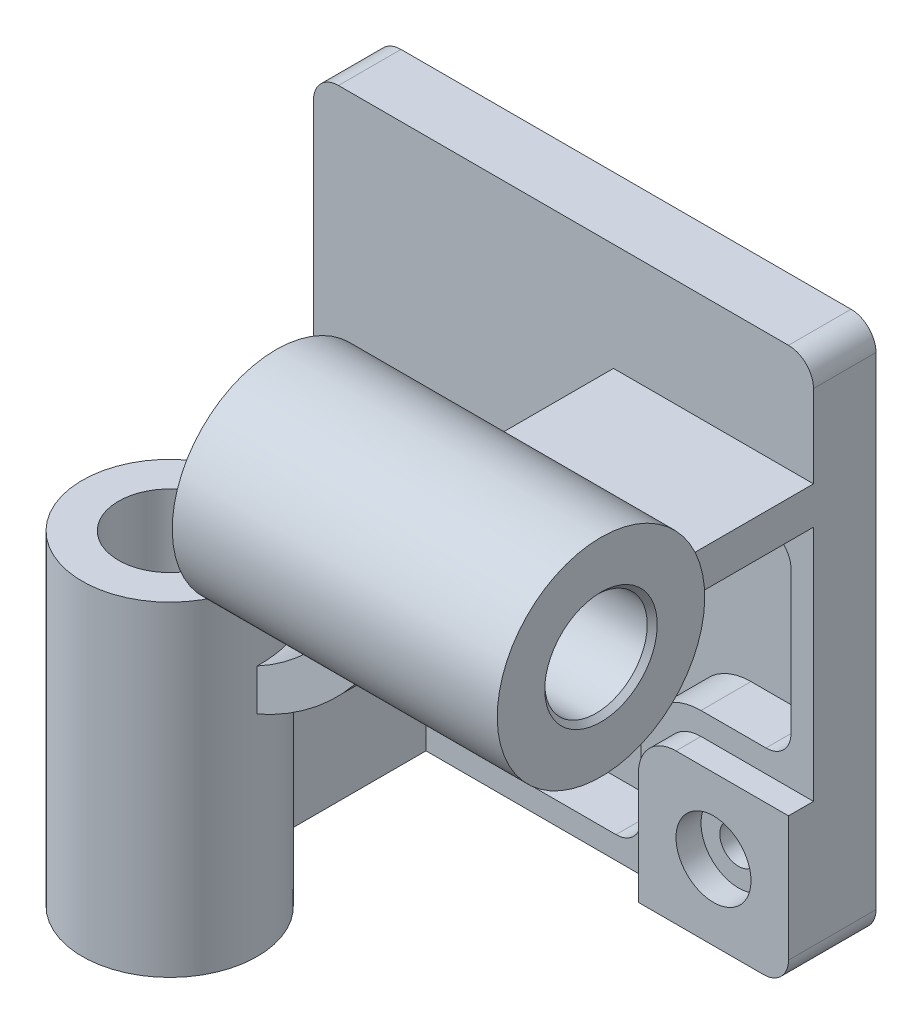
from build123d import *

# Parameters (mm, degrees)
SKETCH1_W                               = 200
SKETCH1_H                               = 213
BOSS_EXTRUDE1_DEPTH                     = 25
BOSS_EXTRUDE2_DEPTH                     = 10
FILLET1_R                               = 10
EXTRUDE_THIN1_DEPTH                     = 95
BOSS_EXTRUDE3_DEPTH                     = 10
BOSS_EXTRUDE3_DEPTH_BACK                = 120
SKETCH5_R                               = 35
BOSS_EXTRUDE4_DEPTH                     = 10
BOSS_EXTRUDE4_DEPTH_BACK                = 120
SKETCH6_R                               = 41.5
CUT_EXTRUDE1_REACH                      = 298.498
SKETCH7_R                               = 20.5
CUT_EXTRUDE2_REACH                      = 291.404
SKETCH8_R                               = 20.5
CHAMFER1_SIZE                           = 2
CUT_EXTRUDE3_DEPTH                      = 20
CBORE_FOR_M8_HEX_HEAD_BOLT1_D           = 15
CBORE_FOR_M8_HEX_HEAD_BOLT1_CBORE_D     = 30
CBORE_FOR_M8_HEX_HEAD_BOLT1_CBORE_DEPTH = 10


with BuildPart() as part:
    # Sketch1 → Boss-Extrude1 (new body)
    with BuildSketch(Plane.XY):
        Rectangle(SKETCH1_W, SKETCH1_H)
    extrude(amount=BOSS_EXTRUDE1_DEPTH)

    # Sketch3 → Boss-Extrude2 (add)
    with BuildSketch(Plane.XY.offset(25)):
        with BuildLine():
            Line((100, -106.5), (40, -106.5))
            Line((40, -106.5), (40, -61.5))
            ThreePointArc((40, -61.5), (44.393398282, -50.893398282), (55, -46.5))
            Line((55, -46.5), (100, -46.5))
            Line((100, -46.5), (100, -106.5))
        make_face()
    extrude(amount=BOSS_EXTRUDE2_DEPTH)

    # Fillet1
    fillet1_edges = [part.edges().sort_by_distance(p)[0] for p in [
        (100, -106.5, 17.5),
        (-100, -106.5, 12.5),
        (-100, 106.5, 12.5),
        (100, 106.5, 12.5),
    ]]
    fillet(fillet1_edges, radius=FILLET1_R)

    # Sketch4 → Extrude-Thin1 (add)
    with BuildSketch(Plane.XY.offset(25)):
        with BuildLine():
            Line((100, 63.5), (20, 63.5))
            ThreePointArc((20, 63.5), (-6.360389693, -0.139610307), (-70, -26.5))
            Line((-70, -26.5), (-70, -106.5))
            Line((-70, -106.5), (-60, -106.5))
            Line((-60, -106.5), (-60, -35.998743711))
            ThreePointArc((-60, -35.998743711), (0.710678119, -7.210678119), (29.498743711, 53.5))
            Line((29.498743711, 53.5), (100, 53.5))
            Line((100, 53.5), (100, 63.5))
        make_face()
        with BuildLine():
            Line((-55, -106.5), (-55, -40.423048454))
            ThreePointArc((-55, -40.423048454), (4.246212025, -10.746212025), (33.923048454, 48.5))
            Line((33.923048454, 48.5), (100, 48.5))
            Line((100, 48.5), (100, 58.5))
            Line((100, 58.5), (24.868329805, 58.5))
            ThreePointArc((24.868329805, 58.5), (-2.824855787, -3.675144213), (-65, -31.368329805))
            Line((-65, -31.368329805), (-65, -106.5))
            Line((-65, -106.5), (-55, -106.5))
        make_face()
    extrude(amount=EXTRUDE_THIN1_DEPTH)

    # Sketch5 → Boss-Extrude3 (add, two sides: drawn at the far end of the back side and taken through both)
    with BuildSketch(Plane.XZ.offset(106.5).offset(-BOSS_EXTRUDE3_DEPTH_BACK)):
        with Locations(Location((-62.5, 120, 0), (0, 0, 270))):
            Circle(SKETCH5_R)
    extrude(amount=BOSS_EXTRUDE3_DEPTH + BOSS_EXTRUDE3_DEPTH_BACK)

    # Sketch6 → Boss-Extrude4 (add, two sides: drawn at the far end of the back side and taken through both)
    with BuildSketch(Plane(origin=(100, 0, 0), x_dir=(0, 0, -1), z_dir=(1, 0, 0)).offset(-BOSS_EXTRUDE4_DEPTH_BACK)):
        with Locations(Location((-120, 56, 0), (0, 0, 90))):
            Circle(SKETCH6_R)
    extrude(amount=BOSS_EXTRUDE4_DEPTH + BOSS_EXTRUDE4_DEPTH_BACK)

    # Sketch7 → Cut-Extrude1 (cut, up to next)
    with BuildSketch(Plane.XZ.offset(116.5), mode=Mode.PRIVATE) as cut_extrude1_sk1:
        with Locations(Location((-62.5, 120, 0), (0, 0, 270))):
            Circle(SKETCH7_R)
    cut_extrude1_tool1 = extrude(cut_extrude1_sk1.sketch, amount=-CUT_EXTRUDE1_REACH, mode=Mode.PRIVATE) & part.part
    add(cut_extrude1_tool1.solids().sort_by_distance((-62.5, -116.5, 120))[0], mode=Mode.SUBTRACT)

    # Sketch8 → Cut-Extrude2 (cut, up to next)
    with BuildSketch(Plane(origin=(110, 0, 0), x_dir=(0, 0, -1), z_dir=(1, 0, 0)), mode=Mode.PRIVATE) as cut_extrude2_sk1:
        with Locations(Location((-120, 56, 0), (0, 0, 90))):
            Circle(SKETCH8_R)
    cut_extrude2_tool1 = extrude(cut_extrude2_sk1.sketch, amount=-CUT_EXTRUDE2_REACH, mode=Mode.PRIVATE) & part.part
    add(cut_extrude2_tool1.solids().sort_by_distance((110, 56, 120))[0], mode=Mode.SUBTRACT)

    # Chamfer1
    chamfer1_edges = [part.edges().sort_by_distance(p)[0] for p in [
        (-62.5, -116.5, 140.5),
        (110, 35.5, 120),
    ]]
    chamfer(chamfer1_edges, length=CHAMFER1_SIZE)

    # Sketch9 → Cut-Extrude3 (cut)
    with BuildSketch(Plane.XY.offset(25)):
        with BuildLine():
            Line((-46, -55.747641486), (-46, -87.5))
            ThreePointArc((-46, -87.5), (-43.071067812, -94.571067812), (-36, -97.5))
            Line((-36, -97.5), (21, -97.5))
            ThreePointArc((21, -97.5), (28.071067812, -94.571067812), (31, -87.5))
            Line((31, -87.5), (31, -61.5))
            ThreePointArc((31, -61.5), (38.029437252, -44.529437252), (55, -37.5))
            Line((55, -37.5), (81, -37.5))
            ThreePointArc((81, -37.5), (88.071067812, -34.571067812), (91, -27.5))
            Line((91, -27.5), (91, 29.5))
            ThreePointArc((91, 29.5), (88.071067812, 36.571067812), (81, 39.5))
            Line((81, 39.5), (49.247641486, 39.5))
            ThreePointArc((49.247641486, 39.5), (43.223496519, 37.481834214), (39.630896205, 32.241935484))
            ThreePointArc((39.630896205, 32.241935484), (10.610173055, -17.110173055), (-38.741935484, -46.130896205))
            ThreePointArc((-38.741935484, -46.130896205), (-43.981834214, -49.723496519), (-46, -55.747641486))
        make_face()
    extrude(amount=-CUT_EXTRUDE3_DEPTH, mode=Mode.SUBTRACT)

    # CBORE for M8 Hex Head Bolt1 (through all)
    with Locations(Plane.XY.offset(35)):
        with Locations((70, -76.5)):
            CounterBoreHole(CBORE_FOR_M8_HEX_HEAD_BOLT1_D / 2, CBORE_FOR_M8_HEX_HEAD_BOLT1_CBORE_D / 2, CBORE_FOR_M8_HEX_HEAD_BOLT1_CBORE_DEPTH)


solid = part.part
